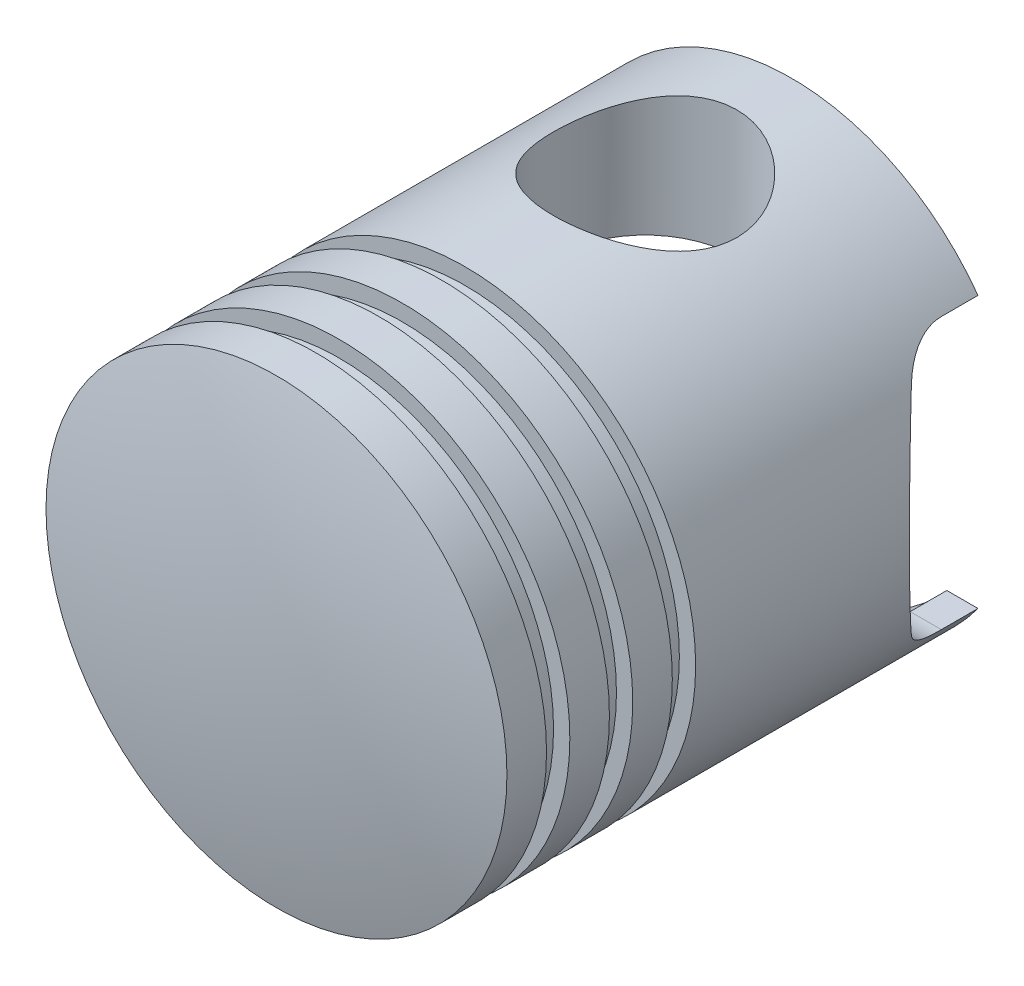
from build123d import *

# Parameters (mm, degrees)
SKETCH1_R                = 42.5
BOSS_EXTRUDE1_DEPTH      = 95
CUT_EXTRUDE1_START       = -7.3
SKETCH2_OUTSIDE_W        = 117.644
SKETCH2_OUTSIDE_H        = 117.644
SKETCH2_OUTSIDE_R        = 39.5
CUT_EXTRUDE1_DEPTH       = 4.3
LPATTERN1_COUNT          = 3
LPATTERN1_PITCH          = 11.6
SKETCH3_R                = 38
CUT_EXTRUDE2_DEPTH       = 85
DOME1_FACE_RADIUS        = 42.5
DOME1_HEIGHT             = 5
CUT_EXTRUDE3_DEPTH       = 117.672618896
CUT_EXTRUDE3_DEPTH_BACK  = 117.672618896
SKETCH5_R                = 16.9
CUT_EXTRUDE4_DEPTH       = 117.672618969
CUT_EXTRUDE4_DEPTH_BACK  = 117.672618969
FILLET1_R                = 10
BOSS_EXTRUDE3_REACH      = 137.673
BOSS_EXTRUDE3_END_RADIUS = 38
BOSS_EXTRUDE3_START      = 19
SKETCH8_R                = 22.5
SKETCH8_R_2              = 16.9


with BuildPart() as part:
    # Sketch1 → Boss-Extrude1 (new body)
    with BuildSketch(Plane.XY):
        Circle(SKETCH1_R)
    extrude(amount=BOSS_EXTRUDE1_DEPTH)

    # Sketch2 outside → Cut-Extrude1 (cut)
    with BuildSketch(Plane.XY.offset(95).offset(CUT_EXTRUDE1_START)):
        Rectangle(SKETCH2_OUTSIDE_W, SKETCH2_OUTSIDE_H)
        Circle(SKETCH2_OUTSIDE_R, mode=Mode.SUBTRACT)
    cut_extrude1 = extrude(amount=-CUT_EXTRUDE1_DEPTH, mode=Mode.SUBTRACT)

    # LPattern1: Cut-Extrude1 ×3
    with Locations(*[(0, 0, -i * LPATTERN1_PITCH) for i in range(1, LPATTERN1_COUNT)]):
        add(cut_extrude1, mode=Mode.SUBTRACT)

    # Sketch3 → Cut-Extrude2 (cut)
    with BuildSketch(Plane(origin=(0, 0, 0), x_dir=(-1, 0, 0), z_dir=(0, 0, -1))):
        Circle(SKETCH3_R)
    extrude(amount=-CUT_EXTRUDE2_DEPTH, mode=Mode.SUBTRACT)

    # Dome1: a dome of height H over a round flat face of radius A is a cap of a sphere of radius (A * A + H * H) / (2 * H)
    dome1_r = (DOME1_FACE_RADIUS * DOME1_FACE_RADIUS + DOME1_HEIGHT * DOME1_HEIGHT) / (2 * DOME1_HEIGHT)
    dome1_base = Plane((0, 0, 95), z_dir=(0, 0, 1))
    with Locations(dome1_base.offset(DOME1_HEIGHT - dome1_r)):
        dome1_ball = Sphere(dome1_r, mode=Mode.PRIVATE)
    add(split(dome1_ball, bisect_by=dome1_base, keep=Keep.TOP, mode=Mode.PRIVATE))

    # Sketch5 → Cut-Extrude3 (cut, two sides: drawn at the far end of the back side and taken through both)
    with BuildSketch(Plane(origin=(0, 0, 0), x_dir=(1, 0, 0), z_dir=(0, 1, 0)).offset(-CUT_EXTRUDE3_DEPTH_BACK)):
        with Locations(Location((0, -27, 0), (0, 0, 270))):
            Circle(SKETCH5_R)
    extrude(amount=CUT_EXTRUDE3_DEPTH + CUT_EXTRUDE3_DEPTH_BACK, mode=Mode.SUBTRACT)

    # Sketch7 → Cut-Extrude4 (cut, two sides: drawn at the far end of the back side and taken through both)
    with BuildSketch(Plane(origin=(0, 0, 0), x_dir=(0, 0, -1), z_dir=(1, 0, 0)).offset(-CUT_EXTRUDE4_DEPTH_BACK)):
        with BuildLine():
            Line((0, 25), (0, 0))
            Line((0, 0), (0, -25))
            Line((0, -25), (-12, -25))
            ThreePointArc((-12, -25), (-20.775010008, 0), (-12, 25))
            Line((-12, 25), (0, 25))
        make_face()
    extrude(amount=CUT_EXTRUDE4_DEPTH + CUT_EXTRUDE4_DEPTH_BACK, mode=Mode.SUBTRACT)

    # Fillet1
    fillet1_edges = [part.edges().sort_by_distance(p)[0] for p in [
        (31.493746877, 25, 12),
        (-31.493746877, 25, 12),
        (-31.493746877, -25, 12),
        (31.493746877, -25, 12),
    ]]
    fillet(fillet1_edges, radius=FILLET1_R)

    # Boss-Extrude3: up to this cylinder (the profile starts inside it)
    boss_extrude3_end = Plane(origin=(0, 0, 48.863604), z_dir=(0, 0, -1)) * Cylinder(BOSS_EXTRUDE3_END_RADIUS, 352.346, mode=Mode.PRIVATE)
    # Sketch8 → Boss-Extrude3 (add, up to the surface)
    with BuildSketch(Plane(origin=(0, 0, 0), x_dir=(1, 0, 0), z_dir=(0, 1, 0)).offset(BOSS_EXTRUDE3_START), mode=Mode.PRIVATE) as boss_extrude3_sk1:
        with Locations(Location((0, -27, 0), (0, 0, 90))):
            Circle(SKETCH8_R)
        with Locations(Location((0, -27, 0), (0, 0, 270))):
            Circle(SKETCH8_R_2, mode=Mode.SUBTRACT)
    boss_extrude3_tool1 = extrude(boss_extrude3_sk1.sketch, amount=BOSS_EXTRUDE3_REACH, mode=Mode.PRIVATE) & boss_extrude3_end
    boss_extrude3 = boss_extrude3_tool1.solids().sort_by_distance((0, 19, 48.863604))[0]
    add(boss_extrude3)

    # Mirror1: Boss-Extrude3 across plane
    add(boss_extrude3.mirror(Plane.ZX))


solid = part.part
